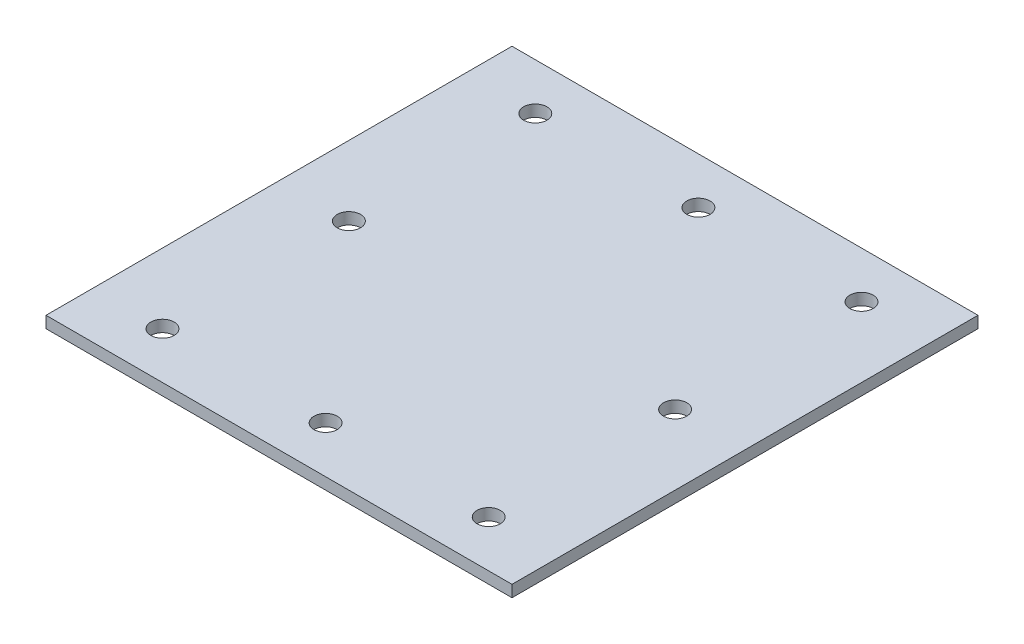
from build123d import *

# Parameters (mm, degrees)
SKETCH1_W           = 508
SKETCH1_H           = 508
BOSS_EXTRUDE1_DEPTH = 12.7
SKETCH2_R           = 12.7
CUT_EXTRUDE1_DEPTH  = 360.434681131


with BuildPart() as part:
    # Sketch1 → Boss-Extrude1 (new body)
    with BuildSketch(Plane(origin=(0, 0, 0), x_dir=(1, 0, 0), z_dir=(0, 1, 0))):
        Rectangle(SKETCH1_W, SKETCH1_H)
    extrude(amount=BOSS_EXTRUDE1_DEPTH)

    # Sketch2 → Cut-Extrude1 (cut, through all)
    with BuildSketch(Plane(origin=(0, 12.7, 0), x_dir=(1, 0, 0), z_dir=(0, 1, 0))):
        with Locations(Location((-177.8, 203.2, 0), (0, 0, 270))):
            Circle(SKETCH2_R)
        with Locations(Location((0, 203.2, 0), (0, 0, 270))):
            Circle(SKETCH2_R)
        with Locations(Location((177.8, 203.2, 0), (0, 0, 270))):
            Circle(SKETCH2_R)
        with Locations(Location((-177.8, 0, 0), (0, 0, 270))):
            Circle(SKETCH2_R)
        with Locations(Location((177.8, 0, 0), (0, 0, 270))):
            Circle(SKETCH2_R)
        with Locations(Location((-177.8, -203.2, 0), (0, 0, 270))):
            Circle(SKETCH2_R)
        with Locations(Location((0, -203.2, 0), (0, 0, 270))):
            Circle(SKETCH2_R)
        with Locations(Location((177.8, -203.2, 0), (0, 0, 270))):
            Circle(SKETCH2_R)
    extrude(amount=-CUT_EXTRUDE1_DEPTH, mode=Mode.SUBTRACT)


solid = part.part
